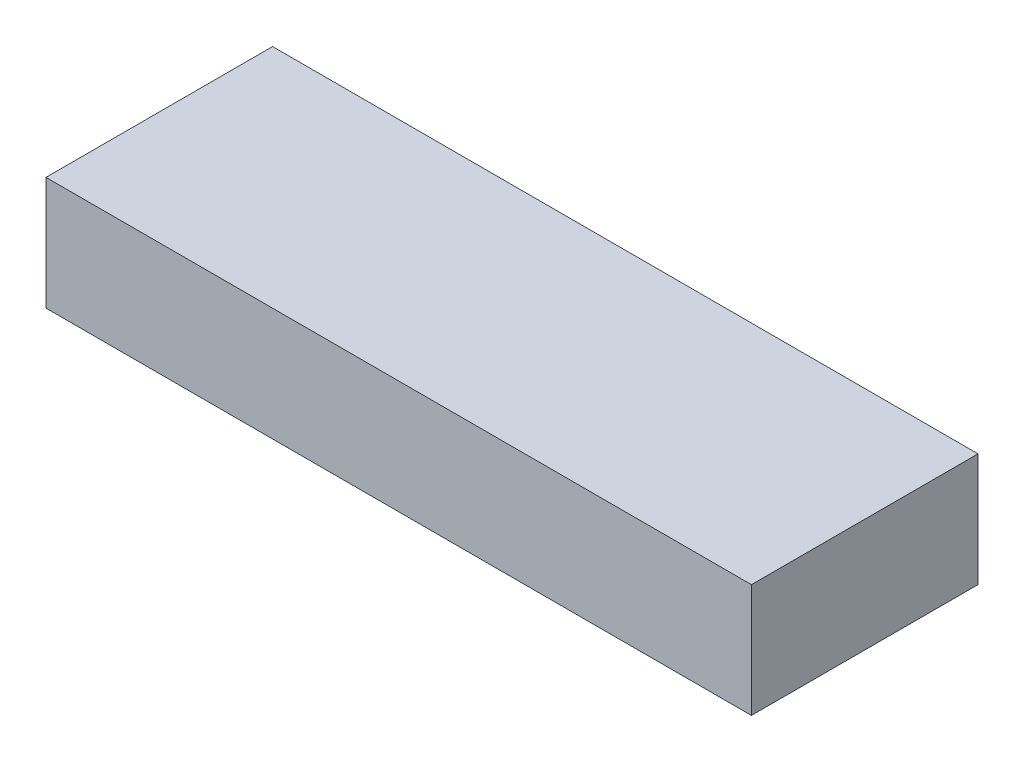
from build123d import *

# Parameters (mm, degrees)
SCHIZZO1_W                   = 137
SCHIZZO1_H                   = 44
ESTRUSIONE_ESTRUSIONE1_DEPTH = 22


with BuildPart() as part:
    # Schizzo1 → Estrusione-Estrusione1 (new body)
    with BuildSketch(Plane(origin=(0, 0, 0), x_dir=(1, 0, 0), z_dir=(0, 1, 0))):
        with Locations((8.808802984, 4.54353229)):
            Rectangle(SCHIZZO1_W, SCHIZZO1_H)
    extrude(amount=ESTRUSIONE_ESTRUSIONE1_DEPTH)


solid = part.part
